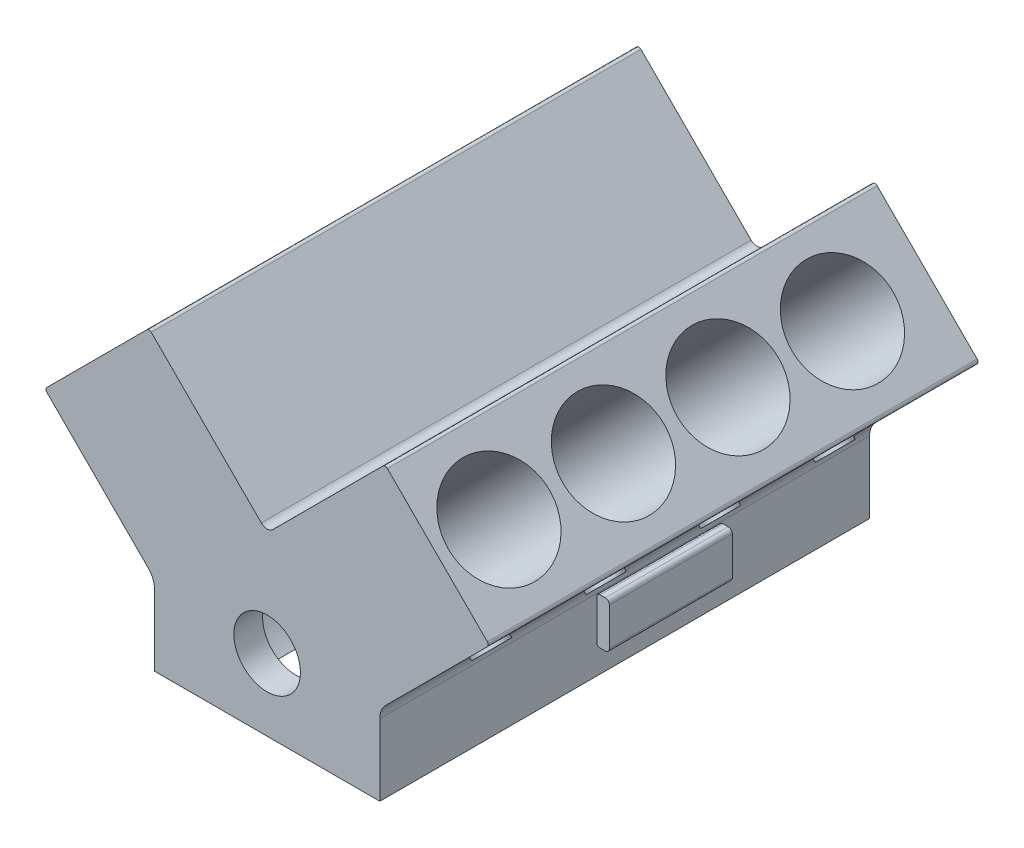
from build123d import *

# Parameters (mm, degrees)
BLOCK_START                  = -406
BLOCK_CASTING_DEPTH          = 478
ENGINE_START                 = -260
ENGINE_MOUNT_PADS_DEPTH      = 120
CRANKCASE_START              = -43.88
SKETCH3_R                    = 92
CRANKCASE_BAY_1_DEPTH        = 87.76
CRANKCASE_START_2            = -155.64
SKETCH4_R                    = 92
CRANKCASE_BAY_2_DEPTH        = 87.76
CRANKCASE_START_3            = -267.4
SKETCH5_R                    = 92
CRANKCASE_BAY_3_DEPTH        = 87.76
CRANKCASE_START_4            = -379.16
SKETCH6_R                    = 92
CRANKCASE_BAY_4_DEPTH        = 87.76
MAIN_BEARING_BORE_DEPTH      = 508.915886668
MAIN_BEARING_BORE_DEPTH_BACK = 508.915886668
SKETCH7_R                    = 32.5
SKETCH8_R                    = 49.5
CYLINDER_BORES_LEFT_DEPTH    = 174.95
SKETCH9_R                    = 16
CORE_PLUGS_LEFT_DEPTH        = 3
SKETCH10_R                   = 49.5
CYLINDER_BORES_RIGHT_DEPTH   = 174.95
SKETCH11_R                   = 16
CORE_PLUGS_RIGHT_DEPTH       = 3


with BuildPart() as part:
    # Sketch1 → Block Casting (new body)
    with BuildSketch(Plane.XY.offset(BLOCK_START)):
        with BuildLine():
            Line((110, -70), (110, -0.107647738))
            ThreePointArc((110, -0.107647738), (111.52240935, 7.546020909), (115.857864376, 14.034487885))
            Line((115.857864376, 14.034487885), (214.925106142, 113.101729651))
            ThreePointArc((214.925106142, 113.101729651), (215.803785798, 115.223049994), (214.925106142, 117.344370338))
            Line((214.925106142, 117.344370338), (117.344370338, 214.925106142))
            ThreePointArc((117.344370338, 214.925106142), (115.223049994, 215.803785798), (113.101729651, 214.925106142))
            Line((113.101729651, 214.925106142), (5.656854249, 107.48023074))
            ThreePointArc((5.656854249, 107.48023074), (0, 105.13708499), (-5.656854249, 107.48023074))
            Line((-5.656854249, 107.48023074), (-113.101729651, 214.925106142))
            ThreePointArc((-113.101729651, 214.925106142), (-115.223049994, 215.803785798), (-117.344370338, 214.925106142))
            Line((-117.344370338, 214.925106142), (-214.925106142, 117.344370338))
            ThreePointArc((-214.925106142, 117.344370338), (-215.803785798, 115.223049994), (-214.925106142, 113.101729651))
            Line((-214.925106142, 113.101729651), (-115.857864376, 14.034487885))
            ThreePointArc((-115.857864376, 14.034487885), (-111.52240935, 7.546020909), (-110, -0.107647738))
            Line((-110, -0.107647738), (-110, -70))
            Line((-110, -70), (110, -70))
        make_face()
    extrude(amount=BLOCK_CASTING_DEPTH)

    # Sketch2 → Engine Mount Pads (add)
    with BuildSketch(Plane.XY.offset(ENGINE_START)):
        with BuildLine():
            Line((113, -45), (118, -45))
            ThreePointArc((118, -45), (120.828427125, -43.828427125), (122, -41))
            Line((122, -41), (122, -4))
            ThreePointArc((122, -4), (120.828427125, -1.171572875), (118, 0))
            Line((118, 0), (113, 0))
            ThreePointArc((113, 0), (110.171572875, -1.171572875), (109, -4))
            Line((109, -4), (109, -41))
            ThreePointArc((109, -41), (110.171572875, -43.828427125), (113, -45))
        make_face()
        with BuildLine():
            Line((-109, -41), (-109, -4))
            ThreePointArc((-109, -4), (-110.171572875, -1.171572875), (-113, 0))
            Line((-113, 0), (-118, 0))
            ThreePointArc((-118, 0), (-120.828427125, -1.171572875), (-122, -4))
            Line((-122, -4), (-122, -41))
            ThreePointArc((-122, -41), (-120.828427125, -43.828427125), (-118, -45))
            Line((-118, -45), (-113, -45))
            ThreePointArc((-113, -45), (-110.171572875, -43.828427125), (-109, -41))
        make_face()
    extrude(amount=ENGINE_MOUNT_PADS_DEPTH)

    # Sketch3 → Crankcase Bay 1 (cut)
    with BuildSketch(Plane.XY.offset(CRANKCASE_START)):
        Circle(SKETCH3_R)
    extrude(amount=CRANKCASE_BAY_1_DEPTH, mode=Mode.SUBTRACT)

    # Sketch4 → Crankcase Bay 2 (cut)
    with BuildSketch(Plane.XY.offset(CRANKCASE_START_2)):
        Circle(SKETCH4_R)
    extrude(amount=CRANKCASE_BAY_2_DEPTH, mode=Mode.SUBTRACT)

    # Sketch5 → Crankcase Bay 3 (cut)
    with BuildSketch(Plane.XY.offset(CRANKCASE_START_3)):
        Circle(SKETCH5_R)
    extrude(amount=CRANKCASE_BAY_3_DEPTH, mode=Mode.SUBTRACT)

    # Sketch6 → Crankcase Bay 4 (cut)
    with BuildSketch(Plane.XY.offset(CRANKCASE_START_4)):
        Circle(SKETCH6_R)
    extrude(amount=CRANKCASE_BAY_4_DEPTH, mode=Mode.SUBTRACT)

    # Sketch7 → Main Bearing Bore (cut, two sides: drawn at the far end of the back side and taken through both)
    with BuildSketch(Plane.XY.offset(-MAIN_BEARING_BORE_DEPTH_BACK)):
        Circle(SKETCH7_R)
    extrude(amount=MAIN_BEARING_BORE_DEPTH + MAIN_BEARING_BORE_DEPTH_BACK, mode=Mode.SUBTRACT)

    # Sketch8 → Cylinder Bores Left (cut)
    with BuildSketch(Plane(origin=(166.13473824, 166.13473824, 0), x_dir=(0, 0, -1), z_dir=(0.7071067811865477, 0.7071067811865475, 0))):
        with Locations((-11.9, 0)):
            Circle(SKETCH8_R)
        with Locations((99.86, 0)):
            Circle(SKETCH8_R)
        with Locations((211.62, 0)):
            Circle(SKETCH8_R)
        with Locations((323.38, 0)):
            Circle(SKETCH8_R)
    extrude(amount=-CYLINDER_BORES_LEFT_DEPTH, mode=Mode.SUBTRACT)

    # Sketch9 → Core Plugs Left (add)
    with BuildSketch(Plane(origin=(50.911688245, -50.911688245, 0), x_dir=(0, 0, -1), z_dir=(0.7071067811865476, -0.7071067811865476, 0))):
        with Locations((-11.9, 150)):
            Circle(SKETCH9_R)
        with Locations((99.86, 150)):
            Circle(SKETCH9_R)
        with Locations((211.62, 150)):
            Circle(SKETCH9_R)
        with Locations((323.38, 150)):
            Circle(SKETCH9_R)
    extrude(amount=CORE_PLUGS_LEFT_DEPTH)

    # Sketch10 → Cylinder Bores Right (cut)
    with BuildSketch(Plane(origin=(-166.13473824, 166.13473824, 0), x_dir=(0, 0, 1), z_dir=(-0.7071067811865477, 0.7071067811865475, 0))):
        with Locations((-11.9, 0)):
            Circle(SKETCH10_R)
        with Locations((-123.66, 0)):
            Circle(SKETCH10_R)
        with Locations((-235.42, 0)):
            Circle(SKETCH10_R)
        with Locations((-347.18, 0)):
            Circle(SKETCH10_R)
    extrude(amount=-CYLINDER_BORES_RIGHT_DEPTH, mode=Mode.SUBTRACT)

    # Sketch11 → Core Plugs Right (add)
    with BuildSketch(Plane(origin=(-50.911688245, -50.911688245, 0), x_dir=(0, 0, 1), z_dir=(-0.7071067811865476, -0.7071067811865476, 0))):
        with Locations((-11.9, 150)):
            Circle(SKETCH11_R)
        with Locations((-123.66, 150)):
            Circle(SKETCH11_R)
        with Locations((-235.42, 150)):
            Circle(SKETCH11_R)
        with Locations((-347.18, 150)):
            Circle(SKETCH11_R)
    extrude(amount=CORE_PLUGS_RIGHT_DEPTH)


solid = part.part
